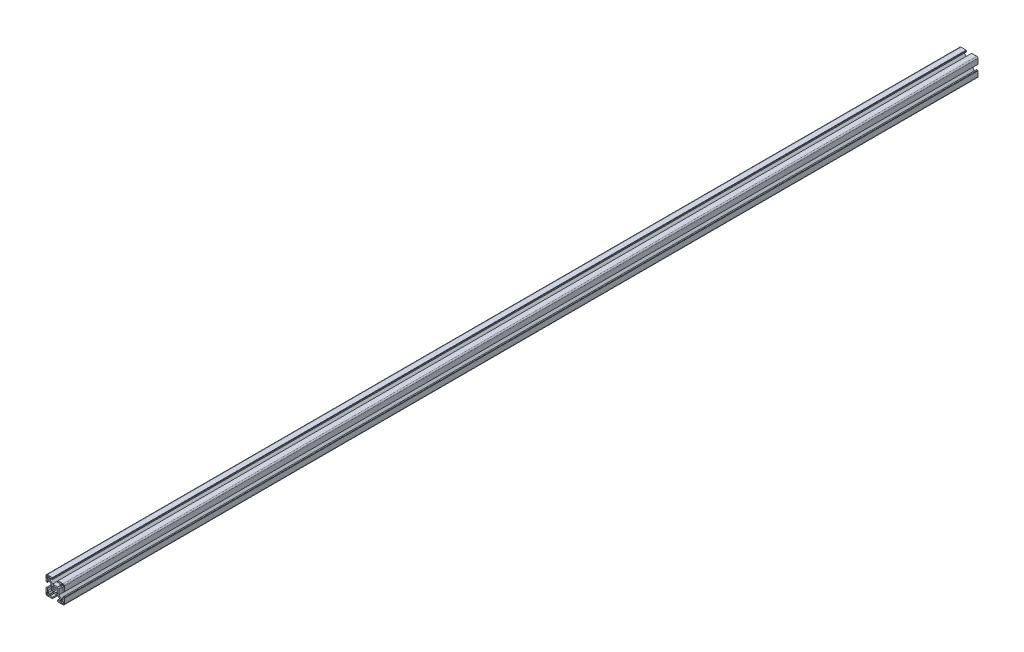
from build123d import *

# Parameters (mm, degrees)
SKETCH3_W           = 3.68
SKETCH3_H           = 3.68
BOSS_EXTRUDE1_DEPTH = 1219.2
SKETCH5_W           = 30
SKETCH5_H           = 938.4
CUT_EXTRUDE1_DEPTH  = 1220.661280848


with BuildPart() as part:
    # Sketch3 → Boss-Extrude1 (new, symmetric)
    with BuildSketch(Plane.XY):
        with BuildLine():
            Line((-4.203948776, 6), (0, 6))
            Line((0, 6), (4.203948776, 6))
            Line((4.203948776, 6), (8.2, 9.996051224))
            Line((8.2, 9.996051224), (8.2, 12.71))
            Line((8.2, 12.71), (4, 12.71))
            Line((4, 12.71), (4, 14.5))
            Line((4, 14.5), (4.5, 14.5))
            Line((4.5, 14.5), (4.5, 15))
            Line((4.5, 15), (12.968, 15))
            ThreePointArc((12.968, 15), (14.404840979, 14.404840979), (15, 12.968))
            Line((15, 12.968), (15, 4.5))
            Line((15, 4.5), (14.5, 4.5))
            Line((14.5, 4.5), (14.5, 4))
            Line((14.5, 4), (12.71, 4))
            Line((12.71, 4), (12.71, 8.2))
            Line((12.71, 8.2), (9.996051224, 8.2))
            Line((9.996051224, 8.2), (6, 4.203948776))
            Line((6, 4.203948776), (6, 0))
            Line((6, 0), (6, -4.203948776))
            Line((6, -4.203948776), (9.996051224, -8.2))
            Line((9.996051224, -8.2), (12.71, -8.2))
            Line((12.71, -8.2), (12.71, -4))
            Line((12.71, -4), (14.5, -4))
            Line((14.5, -4), (14.5, -4.5))
            Line((14.5, -4.5), (15, -4.5))
            Line((15, -4.5), (15, -12.968))
            ThreePointArc((15, -12.968), (14.404840979, -14.404840979), (12.968, -15))
            Line((12.968, -15), (4.5, -15))
            Line((4.5, -15), (4.5, -14.5))
            Line((4.5, -14.5), (4, -14.5))
            Line((4, -14.5), (4, -12.71))
            Line((4, -12.71), (8.2, -12.71))
            Line((8.2, -12.71), (8.2, -9.996051224))
            Line((8.2, -9.996051224), (4.203948776, -6))
            Line((4.203948776, -6), (0, -6))
            Line((0, -6), (-4.203948776, -6))
            Line((-4.203948776, -6), (-8.2, -9.996051224))
            Line((-8.2, -9.996051224), (-8.2, -12.71))
            Line((-8.2, -12.71), (-4, -12.71))
            Line((-4, -12.71), (-4, -14.5))
            Line((-4, -14.5), (-4.5, -14.5))
            Line((-4.5, -14.5), (-4.5, -15))
            Line((-4.5, -15), (-12.968, -15))
            ThreePointArc((-12.968, -15), (-14.404840979, -14.404840979), (-15, -12.968))
            Line((-15, -12.968), (-15, -4.5))
            Line((-15, -4.5), (-14.5, -4.5))
            Line((-14.5, -4.5), (-14.5, -4))
            Line((-14.5, -4), (-12.71, -4))
            Line((-12.71, -4), (-12.71, -8.2))
            Line((-12.71, -8.2), (-9.996051224, -8.2))
            Line((-9.996051224, -8.2), (-6, -4.203948776))
            Line((-6, -4.203948776), (-6, 0))
            Line((-6, 0), (-6, 4.203948776))
            Line((-6, 4.203948776), (-9.996051224, 8.2))
            Line((-9.996051224, 8.2), (-12.71, 8.2))
            Line((-12.71, 8.2), (-12.71, 4))
            Line((-12.71, 4), (-14.5, 4))
            Line((-14.5, 4), (-14.5, 4.5))
            Line((-14.5, 4.5), (-15, 4.5))
            Line((-15, 4.5), (-15, 12.968))
            ThreePointArc((-15, 12.968), (-14.404840979, 14.404840979), (-12.968, 15))
            Line((-12.968, 15), (-4.5, 15))
            Line((-4.5, 15), (-4.5, 14.5))
            Line((-4.5, 14.5), (-4, 14.5))
            Line((-4, 14.5), (-4, 12.71))
            Line((-4, 12.71), (-8.2, 12.71))
            Line((-8.2, 12.71), (-8.2, 9.996051224))
            Line((-8.2, 9.996051224), (-4.203948776, 6))
        make_face()
        with Locations((-11.63, 11.63)):
            Rectangle(SKETCH3_W, SKETCH3_H, mode=Mode.SUBTRACT)
        with BuildLine():
            Line((-3.143089642, 4.493663594), (-1.705676589, 3.056250541))
            ThreePointArc((-1.705676589, 3.056250541), (0, 3.5), (1.705676589, 3.056250541))
            Line((1.705676589, 3.056250541), (3.143089642, 4.493663594))
            Line((3.143089642, 4.493663594), (4.493663594, 3.143089642))
            Line((4.493663594, 3.143089642), (3.056250541, 1.705676589))
            ThreePointArc((3.056250541, 1.705676589), (3.5, 0), (3.056250541, -1.705676589))
            Line((3.056250541, -1.705676589), (4.493663594, -3.143089642))
            Line((4.493663594, -3.143089642), (3.143089642, -4.493663594))
            Line((3.143089642, -4.493663594), (1.705676589, -3.056250541))
            ThreePointArc((1.705676589, -3.056250541), (0, -3.5), (-1.705676589, -3.056250541))
            Line((-1.705676589, -3.056250541), (-3.143089642, -4.493663594))
            Line((-3.143089642, -4.493663594), (-4.493663594, -3.143089642))
            Line((-4.493663594, -3.143089642), (-3.056250541, -1.705676589))
            ThreePointArc((-3.056250541, -1.705676589), (-3.5, 0), (-3.056250541, 1.705676589))
            Line((-3.056250541, 1.705676589), (-4.493663594, 3.143089642))
            Line((-4.493663594, 3.143089642), (-3.143089642, 4.493663594))
        make_face(mode=Mode.SUBTRACT)
        with Locations((11.63, 11.63)):
            Rectangle(SKETCH3_W, SKETCH3_H, mode=Mode.SUBTRACT)
        with Locations((11.63, -11.63)):
            Rectangle(SKETCH3_W, SKETCH3_H, mode=Mode.SUBTRACT)
        with Locations((-11.63, -11.63)):
            Rectangle(SKETCH3_W, SKETCH3_H, mode=Mode.SUBTRACT)
    extrude(amount=BOSS_EXTRUDE1_DEPTH, both=True)

    # Sketch5 → Cut-Extrude1 (cut, through all)
    with BuildSketch(Plane(origin=(0, 15, 0), x_dir=(1, 0, 0), z_dir=(0, 1, 0))):
        with Locations((0, 750)):
            Rectangle(SKETCH5_W, SKETCH5_H)
    extrude(amount=-CUT_EXTRUDE1_DEPTH, mode=Mode.SUBTRACT)


solid = part.part
